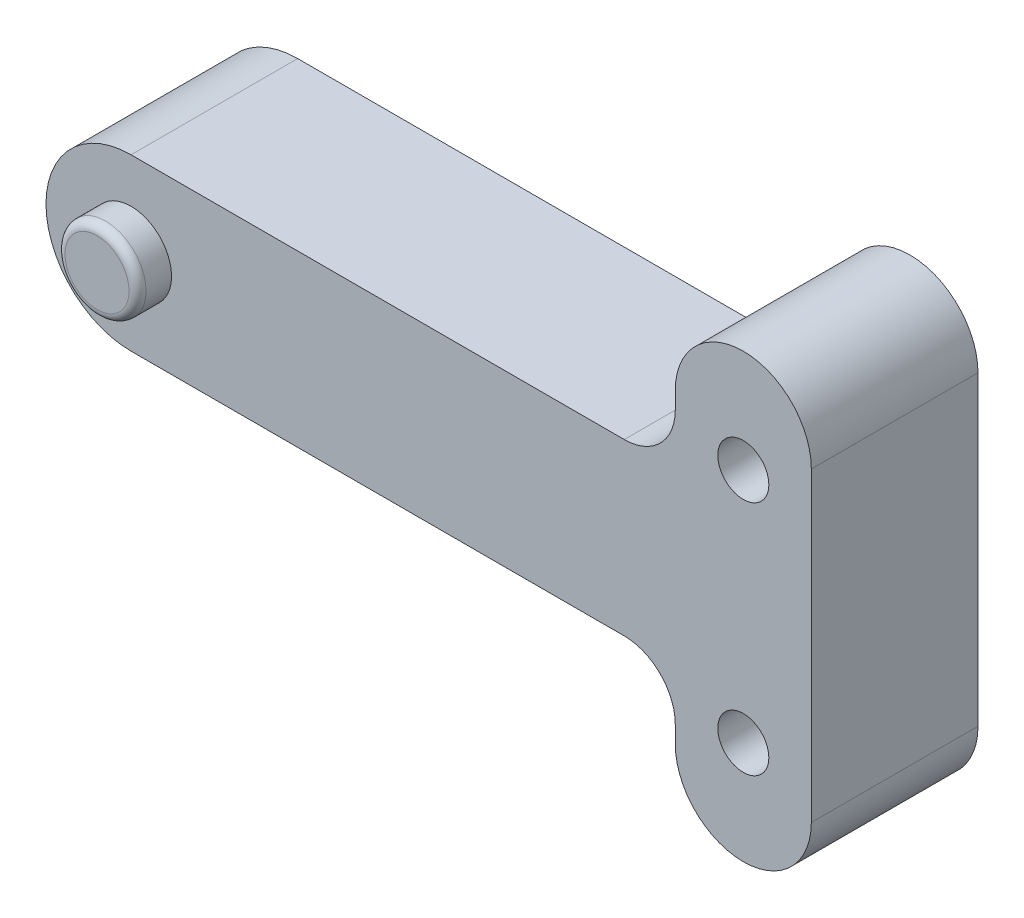
from build123d import *

# Parameters (mm, degrees)
SKETCH1_W                       = 20
SKETCH1_H                       = 20
BOSS_EXTRUDE1_DEPTH             = 20
CUT_EXTRUDE1_DEPTH              = 43.426406871
CUT_EXTRUDE1_DEPTH_BACK         = 43.426406871
CUT_EXTRUDE3_DEPTH              = 25.494897428
CUT_EXTRUDE3_DEPTH_BACK         = 25.494897428
SKETCH3_W                       = 15
SKETCH3_H                       = 15.1
BOSS_EXTRUDE3_DEPTH             = 6.9
BOSS_EXTRUDE3_DEPTH_BACK        = 6.9
SKETCH5_R                       = 2.38
FILLET1_R                       = 0.5
SKETCH7_W                       = 9.8
SKETCH7_H                       = 10
BOSS_EXTRUDE4_DEPTH             = 30
BOSS_EXTRUDE5_REACH             = 42.898
BOSS_EXTRUDE5_DIRECTION_2_REACH = 42.898
CUT_EXTRUDE4_DEPTH              = 43.621708084
CUT_EXTRUDE4_DEPTH_BACK         = 43.621708084
FILLET2_R                       = 3


with BuildPart() as part:
    # Sketch1 → Boss-Extrude1 (new, symmetric)
    with BuildSketch(Plane.XY):
        Rectangle(SKETCH1_W, SKETCH1_H)
    extrude(amount=BOSS_EXTRUDE1_DEPTH, both=True)

    # Sketch2 → Cut-Extrude1 (cut, two sides: drawn at the far end of the back side and taken through both)
    with BuildSketch(Plane.XY.offset(20).offset(-CUT_EXTRUDE1_DEPTH_BACK)):
        with BuildLine():
            ThreePointArc((0, -5), (-5, 0), (0, 5))
            Line((0, 5), (10, 5))
            Line((10, 5), (10, 10))
            Line((10, 10), (-10, 10))
            Line((-10, 10), (-10, -10))
            Line((-10, -10), (10, -10))
            Line((10, -10), (10, -5))
            Line((10, -5), (0, -5))
        make_face()
    extrude(amount=CUT_EXTRUDE1_DEPTH + CUT_EXTRUDE1_DEPTH_BACK, mode=Mode.SUBTRACT)

    # Sketch3 → Cut-Extrude3 (cut, two sides: drawn at the far end of the back side and taken through both)
    with BuildSketch(Plane(origin=(0, 5, 0), x_dir=(1, 0, 0), z_dir=(0, 1, 0)).offset(-CUT_EXTRUDE3_DEPTH_BACK)):
        with Locations((2.5, 12.45)):
            Rectangle(SKETCH3_W, SKETCH3_H)
        with Locations((2.5, -12.45)):
            Rectangle(SKETCH3_W, SKETCH3_H)
    extrude(amount=CUT_EXTRUDE3_DEPTH + CUT_EXTRUDE3_DEPTH_BACK, mode=Mode.SUBTRACT)

    # Sketch5 → Boss-Extrude3 (add, two sides: drawn at the far end of the back side and taken through both)
    with BuildSketch(Plane.XY.offset(-BOSS_EXTRUDE3_DEPTH_BACK)):
        Circle(SKETCH5_R)
    extrude(amount=BOSS_EXTRUDE3_DEPTH + BOSS_EXTRUDE3_DEPTH_BACK)

    # Fillet1
    fillet1_edges = [part.edges().sort_by_distance(p)[0] for p in [
        (-2.38, 0, 6.9),
        (-2.38, 0, -6.9),
    ]]
    fillet(fillet1_edges, radius=FILLET1_R)

    # Sketch7 → Boss-Extrude4 (add)
    with BuildSketch(Plane(origin=(10, 0, 0), x_dir=(0, 0, -1), z_dir=(1, 0, 0))):
        Rectangle(SKETCH7_W, SKETCH7_H)
    extrude(amount=BOSS_EXTRUDE4_DEPTH)

    # Boss-Extrude5: up to this face of the body (flat: up to its plane)
    boss_extrude5_end = Plane(part.part.faces().sort_by_distance((18.783256068, 0, 4.9))[0])
    # Sketch11 → Boss-Extrude5 (add, up to the picked face)
    with BuildSketch(Plane.XY, mode=Mode.PRIVATE) as boss_extrude5_sk1:
        with BuildLine():
            Line((40, 9), (40, -9))
            ThreePointArc((40, -9), (36, -13), (32, -9))
            Line((32, -9), (32, 9))
            ThreePointArc((32, 9), (36, 13), (40, 9))
        make_face()
    boss_extrude5_tool1 = split(extrude(boss_extrude5_sk1.sketch, amount=BOSS_EXTRUDE5_REACH, mode=Mode.PRIVATE), bisect_by=boss_extrude5_end, keep=Keep.BOTH, mode=Mode.PRIVATE)
    add(boss_extrude5_tool1.solids().sort_by(Axis((36, 0, 0), (0, 0, 1)))[0])

    # Boss-Extrude5 direction 2: up to this face of the body (flat: up to its plane)
    boss_extrude5_direction_2_end = Plane(part.part.faces().sort_by_distance((18.783256068, 0, -4.9))[0])
    # Sketch11 → Boss-Extrude5 direction 2 (add, up to the picked face)
    with BuildSketch(Plane.XY, mode=Mode.PRIVATE) as boss_extrude5_direction_2_sk1:
        with BuildLine():
            Line((40, 9), (40, -9))
            ThreePointArc((40, -9), (36, -13), (32, -9))
            Line((32, -9), (32, 9))
            ThreePointArc((32, 9), (36, 13), (40, 9))
        make_face()
    boss_extrude5_direction_2_tool1 = split(extrude(boss_extrude5_direction_2_sk1.sketch, amount=-BOSS_EXTRUDE5_DIRECTION_2_REACH, mode=Mode.PRIVATE), bisect_by=boss_extrude5_direction_2_end, keep=Keep.BOTH, mode=Mode.PRIVATE)
    add(boss_extrude5_direction_2_tool1.solids().sort_by(Axis((36, 0, 0), (0, 0, -1)))[0])

    # Sketch13 → Cut-Extrude4 (cut, two sides: drawn at the far end of the back side and taken through both)
    with BuildSketch(Plane.XY.offset(-CUT_EXTRUDE4_DEPTH_BACK)):
        with BuildLine():
            ThreePointArc((37.5, 6.95), (37.060660172, 8.010660172), (36, 8.45))
            Line((36, 8.45), (36, 5.45))
            ThreePointArc((36, 5.45), (37.060660172, 5.889339828), (37.5, 6.95))
        make_face()
        with BuildLine():
            Line((36, 5.45), (36, 8.45))
            ThreePointArc((36, 8.45), (34.5, 6.95), (36, 5.45))
        make_face()
        with BuildLine():
            ThreePointArc((37.5, -6.95), (37.060660172, -5.889339828), (36, -5.45))
            Line((36, -5.45), (36, -8.45))
            ThreePointArc((36, -8.45), (37.060660172, -8.010660172), (37.5, -6.95))
        make_face()
        with BuildLine():
            Line((36, -8.45), (36, -5.45))
            ThreePointArc((36, -5.45), (34.5, -6.95), (36, -8.45))
        make_face()
    extrude(amount=CUT_EXTRUDE4_DEPTH + CUT_EXTRUDE4_DEPTH_BACK, mode=Mode.SUBTRACT)

    # Fillet2
    fillet2_edges = [part.edges().sort_by_distance(p)[0] for p in [
        (32, -5, 0),
        (32, 5, 0),
    ]]
    fillet(fillet2_edges, radius=FILLET2_R)


solid = part.part
